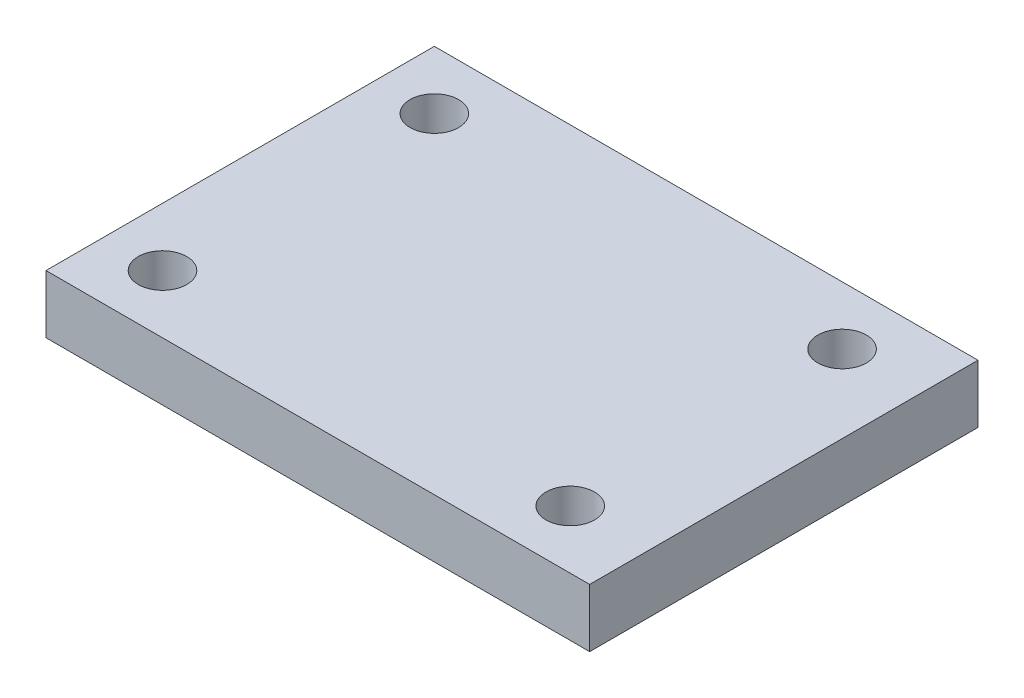
from build123d import *

# Parameters (mm, degrees)
SKETCH1_W           = 28
SKETCH1_H           = 20
BOSS_EXTRUDE1_DEPTH = 3
M3_TAPPED_HOLE1_D   = 2.5


with BuildPart() as part:
    # Sketch1 → Boss-Extrude1 (new body)
    with BuildSketch(Plane(origin=(0, 0, 0), x_dir=(1, 0, 0), z_dir=(0, 1, 0))):
        Rectangle(SKETCH1_W, SKETCH1_H)
    extrude(amount=-BOSS_EXTRUDE1_DEPTH)

    # M3 Tapped Hole1 (through all)
    with Locations(Plane(origin=(0, 0, 0), x_dir=(1, 0, 0), z_dir=(0, 1, 0))):
        with Locations((-11, 7), (-11, -7), (10, 7), (10, -7)):
            Hole(M3_TAPPED_HOLE1_D / 2)


solid = part.part
